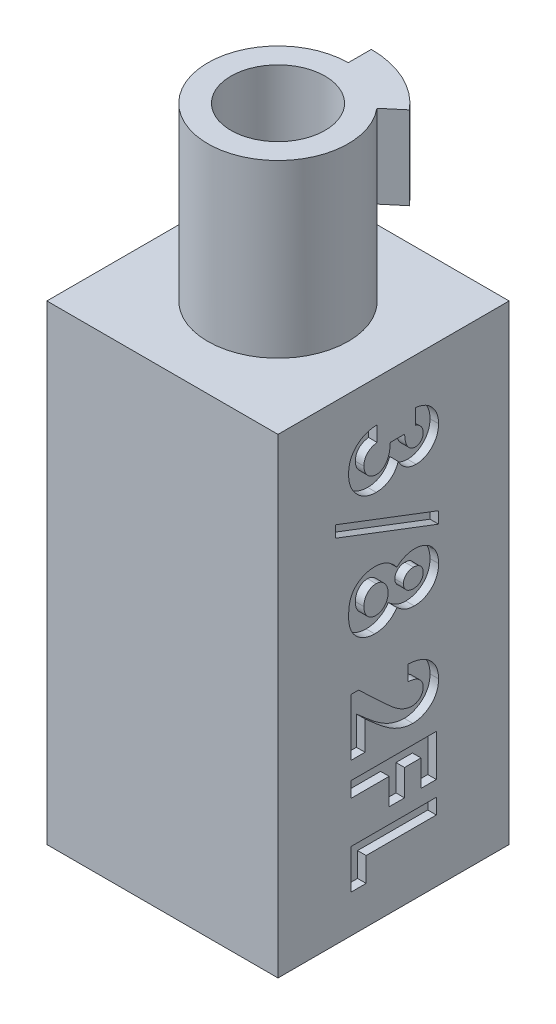
from build123d import *

# Parameters (mm, degrees)
SKETCH1_W           = 27
SKETCH1_H           = 27
BOSS_EXTRUDE1_DEPTH = 10
SKETCH1_3_W         = 27
SKETCH1_3_H         = 27
SKETCH1_3_R         = 5.5
BOSS_EXTRUDE2_DEPTH = 45
SKETCH1_4_R         = 8.2
SKETCH1_4_R_2       = 5.5
BOSS_EXTRUDE3_DEPTH = 65
BOSS_EXTRUDE4_START = -9.7
BOSS_EXTRUDE4_DEPTH = 9.7
CUT_EXTRUDE1_DEPTH  = 1


with BuildPart() as part:
    # Sketch1 → Boss-Extrude1 (new body)
    with BuildSketch(Plane(origin=(0, 0, 0), x_dir=(1, 0, 0), z_dir=(0, 1, 0))):
        Rectangle(SKETCH1_W, SKETCH1_H)
    extrude(amount=-BOSS_EXTRUDE1_DEPTH)

    # Sketch1<3> → Boss-Extrude2 (add)
    with BuildSketch(Plane(origin=(0, 0, 0), x_dir=(1, 0, 0), z_dir=(0, 1, 0))):
        Rectangle(SKETCH1_3_W, SKETCH1_3_H)
        Circle(SKETCH1_3_R, mode=Mode.SUBTRACT)
    extrude(amount=BOSS_EXTRUDE2_DEPTH)

    # Sketch1<4> → Boss-Extrude3 (add)
    with BuildSketch(Plane(origin=(0, 0, 0), x_dir=(1, 0, 0), z_dir=(0, 1, 0))):
        Circle(SKETCH1_4_R)
        Circle(SKETCH1_4_R_2, mode=Mode.SUBTRACT)
    extrude(amount=BOSS_EXTRUDE3_DEPTH)

    # Sketch2 → Boss-Extrude4 (add)
    with BuildSketch(Plane(origin=(0, 65, 0), x_dir=(1, 0, 0), z_dir=(0, 1, 0)).offset(BOSS_EXTRUDE4_START)):
        with BuildLine():
            Line((0, 8.2), (0, 10.9))
            ThreePointArc((0, 10.9), (4.606539053, 9.878754879), (8.34988443, 7.006384946))
            Line((8.34988443, 7.006384946), (6.281564434, 5.270858399))
            ThreePointArc((6.281564434, 5.270858399), (3.465469746, 7.431723854), (0, 8.2))
        make_face()
    extrude(amount=BOSS_EXTRUDE4_DEPTH)

    # Sketch3 → Cut-Extrude1 (cut)
    # profile 1 of 6: a face of its own
    with BuildSketch(Plane(origin=(13.5, 0, 0), x_dir=(0, 0, -1), z_dir=(1, 0, 0))):
        with BuildLine():
            Line((2.564102564, 37.884615385), (2.564102564, 39.679487179))
            add(Edge.make_bspline(
                [(2.564102564, 39.679487179), (2.653821802, 39.666814702), (2.829710425, 39.641971149), (3.084353334, 39.58252385), (3.325899561, 39.511418466), (3.553584178, 39.422647026), (3.767812766, 39.318532569), (3.969320453, 39.200133822), (4.157242331, 39.066170852), (4.270447216, 38.963486815), (4.326923077, 38.912259615)],
                knots=[0, 0, 0, 0, 1.111473889, 2.178970933, 3.205615836, 4.199322666, 5.174200091, 6.12565194, 7.064921805, 8, 8, 8, 8], degree=3))
            add(Edge.make_bspline(
                [(4.326923077, 38.912259615), (4.401438883, 38.838371167), (4.548301705, 38.692744801), (4.736416757, 38.449386063), (4.899217542, 38.194301164), (5.028287182, 37.922374263), (5.132754103, 37.637836747), (5.202924769, 37.338425877), (5.249483626, 37.025365153), (5.254069836, 36.811740592), (5.256410256, 36.702724359)],
                knots=[0, 0, 0, 0, 1.01925491, 2.00884431, 2.983262333, 3.955970413, 4.92937149, 5.924503185, 6.940838805, 8, 8, 8, 8], degree=3))
            add(Edge.make_bspline(
                [(5.256410256, 36.702724359), (5.254122141, 36.605803318), (5.249624166, 36.415276083), (5.213516866, 36.135248986), (5.150188683, 35.868266585), (5.067388504, 35.611506796), (4.954725023, 35.368745719), (4.823946701, 35.134625382), (4.663541655, 34.915687116), (4.482300095, 34.711418647), (4.286269605, 34.523759099), (4.076729133, 34.361245108), (3.859275988, 34.221528914), (3.632103545, 34.10642125), (3.394827401, 34.017919099), (3.148818268, 33.956495981), (2.894618984, 33.91629306), (2.721843154, 33.912287798), (2.634214744, 33.91025641)],
                knots=[0, 0, 0, 0, 1.091422571, 2.145516843, 3.172569842, 4.178562979, 5.178154469, 6.181868002, 7.194278174, 8.227918432, 9.254613415, 10.245994977, 11.209837596, 12.161663635, 13.10878368, 14.055455738, 15.013766427, 16, 16, 16, 16], degree=3))
            add(Edge.make_bspline(
                [(2.634214744, 33.91025641), (2.525694254, 33.914424939), (2.312050773, 33.922631491), (1.999367667, 33.989972192), (1.700386816, 34.095378701), (1.419291414, 34.247648656), (1.156846443, 34.438024882), (0.921826227, 34.671610135), (0.710545967, 34.9417513), (0.59700393, 35.144549872), (0.538862179, 35.248397436)],
                knots=[0, 0, 0, 0, 0.992805628, 1.954529043, 2.915727527, 3.886831945, 4.871318353, 5.87440735, 6.911542536, 8, 8, 8, 8], degree=3))
            add(Edge.make_bspline(
                [(0.538862179, 35.248397436), (0.51545966, 35.177118061), (0.469474759, 35.037057286), (0.378908016, 34.837977736), (0.279933578, 34.648675832), (0.164951371, 34.472411284), (0.038610767, 34.30743093), (-0.10016824, 34.154740509), (-0.251083047, 34.013427731), (-0.414963628, 33.88579947), (-0.589189032, 33.772524401), (-0.769734755, 33.670888714), (-0.959338807, 33.587236877), (-1.15583578, 33.516373358), (-1.360991686, 33.462421909), (-1.574011564, 33.424435267), (-1.7944095, 33.402478056), (-1.943728968, 33.399129207), (-2.019230769, 33.397435897)],
                knots=[0, 0, 0, 0, 1.059543567, 2.081955587, 3.086750234, 4.076226789, 5.052108497, 6.020845489, 6.989030705, 7.970690546, 8.952259656, 9.923888338, 10.895517021, 11.877585046, 12.873342345, 13.889638361, 14.932918083, 16, 16, 16, 16], degree=3))
            add(Edge.make_bspline(
                [(-2.019230769, 33.397435897), (-2.130236535, 33.40057446), (-2.34921031, 33.406765695), (-2.670686578, 33.454024014), (-2.978833227, 33.529931773), (-3.274049635, 33.636569592), (-3.55540839, 33.776230557), (-3.824956262, 33.944768895), (-4.080366401, 34.145210283), (-4.321202383, 34.371745811), (-4.54114502, 34.622515894), (-4.731640109, 34.894689307), (-4.895167518, 35.181929196), (-5.027911275, 35.486146678), (-5.130142383, 35.807211024), (-5.204038893, 36.144413387), (-5.249250209, 36.499168733), (-5.253989743, 36.741317084), (-5.256410256, 36.864983974)],
                knots=[0, 0, 0, 0, 1.00521177, 1.982915163, 2.936446867, 3.875909237, 4.819955514, 5.776532521, 6.750505675, 7.756026749, 8.767695971, 9.766152086, 10.760201606, 11.756952477, 12.766920653, 13.807416198, 14.880231815, 16, 16, 16, 16], degree=3))
            add(Edge.make_bspline(
                [(-5.256410256, 36.864983974), (-5.253858887, 36.981971235), (-5.248870022, 37.210724342), (-5.205668516, 37.545317177), (-5.136029161, 37.863340481), (-5.037699701, 38.165491798), (-4.911012924, 38.450484738), (-4.758099879, 38.719979671), (-4.574275293, 38.971034542), (-4.363876264, 39.204805175), (-4.131072332, 39.419309718), (-3.87396589, 39.606258815), (-3.598174938, 39.768953805), (-3.30310638, 39.908468452), (-2.986127407, 40.017474263), (-2.650068766, 40.104163696), (-2.293477318, 40.164516892), (-2.048155909, 40.182923131), (-1.923076923, 40.192307692)],
                knots=[0, 0, 0, 0, 1.066693477, 2.085777942, 3.071407889, 4.032495163, 4.978645371, 5.911608997, 6.853298848, 7.810770565, 8.776420673, 9.735131334, 10.704462168, 11.693492242, 12.70668109, 13.756973703, 14.856375978, 16, 16, 16, 16], degree=3))
            Line((-1.923076923, 40.192307692), (-1.923076923, 38.397435897))
            add(Edge.make_bspline(
                [(-1.923076923, 38.397435897), (-1.985969191, 38.386061982), (-2.108468375, 38.363908299), (-2.285819962, 38.320698899), (-2.449526431, 38.264391022), (-2.6010428, 38.199285108), (-2.742358427, 38.128960918), (-2.868254176, 38.04399248), (-2.982148633, 37.950605835), (-3.117547618, 37.815848224), (-3.256664424, 37.623202939), (-3.377563545, 37.363067981), (-3.448425284, 37.073692474), (-3.457070199, 36.871390136), (-3.461538462, 36.766826923)],
                knots=[0, 0, 0, 0, 0.928156231, 1.807827665, 2.648129825, 3.438902246, 4.202261636, 4.936546065, 5.639352463, 6.338805438, 7.70633318, 9.064371875, 10.482673459, 12, 12, 12, 12], degree=3))
            add(Edge.make_bspline(
                [(-3.461538462, 36.766826923), (-3.460588929, 36.71134118), (-3.458729009, 36.602657022), (-3.43804467, 36.44302989), (-3.404122878, 36.290910138), (-3.357340249, 36.145672478), (-3.300393632, 36.006135056), (-3.225089708, 35.876234866), (-3.138113652, 35.753305262), (-3.041351593, 35.637575322), (-2.932620978, 35.533578406), (-2.817643329, 35.441834967), (-2.695701233, 35.363867006), (-2.567063036, 35.303246611), (-2.434626712, 35.250920391), (-2.294801222, 35.218704171), (-2.15028413, 35.194438311), (-2.051391816, 35.193024985), (-2.001201923, 35.192307692)],
                knots=[0, 0, 0, 0, 1.110156356, 2.174547939, 3.215517325, 4.225827361, 5.226274409, 6.226006852, 7.223592408, 8.238489974, 9.24054302, 10.230036266, 11.179350721, 12.129887733, 13.073255049, 14.023133956, 14.996699621, 16, 16, 16, 16], degree=3))
            add(Edge.make_bspline(
                [(-2.001201923, 35.192307692), (-1.946309903, 35.194209041), (-1.837032468, 35.197994189), (-1.677565029, 35.228919251), (-1.524170206, 35.277756459), (-1.377527302, 35.345597307), (-1.238176814, 35.436191199), (-1.103322949, 35.54309098), (-0.979984611, 35.674718587), (-0.858068402, 35.819131699), (-0.751794237, 35.986594176), (-0.653718798, 36.168950361), (-0.575681027, 36.370992857), (-0.505978843, 36.587789627), (-0.45506945, 36.823441583), (-0.418104269, 37.076485415), (-0.390589421, 37.346512926), (-0.386641963, 37.532646399), (-0.384615385, 37.628205128)],
                knots=[0, 0, 0, 0, 0.809814727, 1.612155564, 2.388397, 3.182215007, 3.988903953, 4.837162975, 5.715530372, 6.646997145, 7.623086902, 8.637258368, 9.698941581, 10.815059213, 11.996518529, 13.252603015, 14.589518788, 16, 16, 16, 16], degree=3))
            Line((-0.384615385, 37.628205128), (1.282051282, 37.628205128))
            add(Edge.make_bspline(
                [(1.282051282, 37.628205128), (1.292192728, 37.509231218), (1.311165365, 37.286654593), (1.35538504, 36.977671289), (1.415105019, 36.717041177), (1.48590342, 36.498707498), (1.577314096, 36.31767744), (1.680660623, 36.161373941), (1.79637151, 36.024009657), (1.927085689, 35.908793522), (2.068404565, 35.819459688), (2.215392461, 35.754031138), (2.366041964, 35.711239363), (2.469010858, 35.707153002), (2.520032051, 35.705128205)],
                knots=[0, 0, 0, 0, 1.700000582, 3.18036443, 4.43953496, 5.503843555, 6.439238578, 7.317314143, 8.167035247, 8.988963526, 9.788142765, 10.537231438, 11.275196671, 12, 12, 12, 12], degree=3))
            add(Edge.make_bspline(
                [(2.520032051, 35.705128205), (2.585164882, 35.708555447), (2.71229038, 35.715244697), (2.89344968, 35.768571715), (3.056783525, 35.857216326), (3.198059443, 35.980507148), (3.317504747, 36.130123291), (3.402478321, 36.306663441), (3.4536758, 36.504210994), (3.458858217, 36.642976689), (3.461538462, 36.71474359)],
                knots=[0, 0, 0, 0, 1.009121812, 1.969592135, 2.901310697, 3.870954244, 4.859448864, 5.850870115, 6.888512099, 8, 8, 8, 8], degree=3))
            add(Edge.make_bspline(
                [(3.461538462, 36.71474359), (3.458344511, 36.779781352), (3.452006736, 36.908836192), (3.404492731, 37.097476817), (3.325317361, 37.2764162), (3.214132667, 37.441065293), (3.081976174, 37.591019161), (2.926723972, 37.716752429), (2.754448534, 37.81910709), (2.627799957, 37.862693683), (2.564102564, 37.884615385)],
                knots=[0, 0, 0, 0, 0.988439209, 1.961366134, 2.938893463, 3.950078543, 4.971412263, 5.967491143, 6.977757845, 8, 8, 8, 8], degree=3))
        make_face()
    # profile 2 of 6: a face of its own
    with BuildSketch(Plane(origin=(13.5, 0, 0), x_dir=(0, 0, -1), z_dir=(1, 0, 0))):
        Polygon((-6.794871795, 32.497996795), (5.256410256, 27.896634615), (5.256410256, 26.538461538), (-6.794871795, 31.139823718), align=None)
    # profile 3 of 6: a face of its own
    with BuildSketch(Plane(origin=(13.5, 0, 0), x_dir=(0, 0, -1), z_dir=(1, 0, 0))):
        with BuildLine():
            add(Edge.make_bspline(
                [(0.384615385, 20.536858974), (0.30968099, 20.432007711), (0.161355116, 20.224464095), (-0.104244998, 19.950179975), (-0.401313683, 19.714475935), (-0.72541849, 19.516372355), (-1.07184425, 19.359382017), (-1.435854911, 19.250240977), (-1.812735309, 19.178224471), (-2.069645315, 19.170547535), (-2.199519231, 19.166666667)],
                knots=[0, 0, 0, 0, 1.013587101, 2.00630422, 2.994011285, 3.992114894, 4.989775356, 5.97925768, 6.978468294, 8, 8, 8, 8], degree=3))
            add(Edge.make_bspline(
                [(-2.199519231, 19.166666667), (-2.340132714, 19.171414092), (-2.61902151, 19.180830002), (-3.028012621, 19.264078404), (-3.420932225, 19.39773238), (-3.793457423, 19.580389381), (-4.133960118, 19.809433784), (-4.435544593, 20.076314068), (-4.689290726, 20.381341907), (-4.8630938, 20.664150948), (-4.977381769, 20.908342124), (-5.050799141, 21.105705607), (-5.115792489, 21.314712434), (-5.166806089, 21.536474641), (-5.207464416, 21.770495437), (-5.234019706, 22.016099788), (-5.253391407, 22.274000017), (-5.255387006, 22.449880664), (-5.256410256, 22.540064103)],
                knots=[0, 0, 0, 0, 1.313617677, 2.605392066, 3.884780464, 5.185935486, 6.472524403, 7.710665271, 8.938515847, 10.168840141, 10.802872812, 11.45687894, 12.13623113, 12.848002783, 13.582919397, 14.355812389, 15.156936857, 16, 16, 16, 16], degree=3))
            add(Edge.make_bspline(
                [(-5.256410256, 22.540064103), (-5.25510557, 22.6362354), (-5.252557774, 22.82403898), (-5.237156654, 23.098191343), (-5.208750846, 23.356794445), (-5.171394529, 23.60040684), (-5.121830828, 23.828738606), (-5.059608317, 24.041385926), (-4.987335191, 24.238834408), (-4.878722744, 24.481642636), (-4.709884787, 24.760541454), (-4.46031079, 25.060528498), (-4.165000344, 25.324476532), (-3.827663539, 25.550225639), (-3.457007007, 25.734069999), (-3.05826679, 25.867437018), (-2.636062844, 25.947153707), (-2.346765608, 25.956686477), (-2.199519231, 25.961538462)],
                knots=[0, 0, 0, 0, 0.88703354, 1.732201599, 2.531328366, 3.285652326, 4.004418811, 4.684576848, 5.327555525, 5.942246152, 7.135747701, 8.320909842, 9.528957099, 10.7758759, 12.053844946, 13.33337118, 14.64274046, 16, 16, 16, 16], degree=3))
            add(Edge.make_bspline(
                [(-2.199519231, 25.961538462), (-2.071004776, 25.958241945), (-1.818309692, 25.951760078), (-1.44953457, 25.884113384), (-1.097231044, 25.781637119), (-0.764840574, 25.630194832), (-0.446965461, 25.44112569), (-0.148930805, 25.206989397), (0.132906208, 24.932425863), (0.299320606, 24.724142372), (0.384615385, 24.617387821)],
                knots=[0, 0, 0, 0, 1.017764427, 2.001207311, 2.962560812, 3.919839309, 4.888525119, 5.888134187, 6.91757486, 8, 8, 8, 8], degree=3))
            add(Edge.make_bspline(
                [(0.384615385, 24.617387821), (0.460933841, 24.683585927), (0.611181897, 24.813910061), (0.853144307, 24.982218171), (1.101788672, 25.125142572), (1.35816109, 25.241987854), (1.62135474, 25.334959725), (1.892316923, 25.401403725), (2.171042388, 25.439803344), (2.358992717, 25.445726279), (2.453926282, 25.448717949)],
                knots=[0, 0, 0, 0, 1.061613381, 2.089997026, 3.093172129, 4.073384372, 5.048150668, 6.023851993, 7.001849177, 8, 8, 8, 8], degree=3))
            add(Edge.make_bspline(
                [(2.453926282, 25.448717949), (2.582435925, 25.444740918), (2.8359805, 25.43689439), (3.206603965, 25.366950433), (3.55950478, 25.25182147), (3.891145704, 25.091328564), (4.197920109, 24.892024095), (4.471334972, 24.654051268), (4.706277935, 24.377108412), (4.904033024, 24.066344236), (5.063257936, 23.725295248), (5.175056231, 23.355692522), (5.245063738, 22.961394117), (5.252570547, 22.689270522), (5.256410256, 22.550080128)],
                knots=[0, 0, 0, 0, 1.022656772, 2.017662422, 2.99130931, 3.971194851, 4.94315582, 5.896612183, 6.847142801, 7.825150805, 8.821987795, 9.834571622, 10.89238995, 12, 12, 12, 12], degree=3))
            add(Edge.make_bspline(
                [(5.256410256, 22.550080128), (5.252575281, 22.412893406), (5.245097883, 22.145408023), (5.175290406, 21.757433779), (5.061095873, 21.394618114), (4.899817861, 21.059667079), (4.699797094, 20.753212229), (4.457590682, 20.481153641), (4.177132978, 20.244163889), (3.863078164, 20.042583684), (3.524888193, 19.881841805), (3.170183969, 19.763034773), (2.801804331, 19.69430899), (2.551690132, 19.684447539), (2.42588141, 19.679487179)],
                knots=[0, 0, 0, 0, 1.094581014, 2.13420379, 3.135806656, 4.123102114, 5.093187509, 6.048701862, 7.020851006, 8.016190234, 9.020216833, 10.003183799, 10.99559124, 12, 12, 12, 12], degree=3))
            add(Edge.make_bspline(
                [(2.42588141, 19.679487179), (2.336968918, 19.6818812), (2.162484799, 19.686579285), (1.905382751, 19.721188667), (1.658839048, 19.779806129), (1.415927343, 19.860423045), (1.173424275, 19.97717614), (0.919619576, 20.126424209), (0.654011939, 20.316211729), (0.477242408, 20.460993499), (0.384615385, 20.536858974)],
                knots=[0, 0, 0, 0, 0.940860718, 1.84636882, 2.739437118, 3.619946589, 4.54937856, 5.582024627, 6.73298378, 8, 8, 8, 8], degree=3))
        make_face()
        with BuildLine():
            add(Edge.make_bspline(
                [(3.461538462, 22.594150641), (3.457861121, 22.66800846), (3.45067598, 22.812318976), (3.389480157, 23.01802453), (3.285469614, 23.201585701), (3.145483207, 23.360845945), (2.974535412, 23.491572398), (2.778158682, 23.587708484), (2.558591809, 23.644704433), (2.404854157, 23.650739658), (2.325721154, 23.653846154)],
                knots=[0, 0, 0, 0, 1.01799924, 1.989064885, 2.929918886, 3.909649683, 4.895861681, 5.88099644, 6.909290502, 8, 8, 8, 8], degree=3))
            add(Edge.make_bspline(
                [(2.325721154, 23.653846154), (2.245935838, 23.649958449), (2.09014732, 23.64236733), (1.865741634, 23.584081134), (1.663945942, 23.480820867), (1.486563854, 23.343450326), (1.340234372, 23.17757285), (1.230143998, 22.990046999), (1.166783478, 22.780394198), (1.158223171, 22.634628443), (1.153846154, 22.560096154)],
                knots=[0, 0, 0, 0, 1.071552291, 2.092309128, 3.087505052, 4.097995595, 5.089828334, 6.04253265, 6.99911662, 8, 8, 8, 8], degree=3))
            add(Edge.make_bspline(
                [(1.153846154, 22.560096154), (1.157255392, 22.484172537), (1.163897228, 22.336259088), (1.228623422, 22.125835673), (1.333233056, 21.936542229), (1.477850646, 21.77212926), (1.657693776, 21.640316481), (1.863122735, 21.541948774), (2.094437719, 21.48581877), (2.255974927, 21.478272341), (2.33974359, 21.474358974)],
                knots=[0, 0, 0, 0, 1.008634697, 1.965009626, 2.900280074, 3.870523963, 4.855685917, 5.849953663, 6.885046307, 8, 8, 8, 8], degree=3))
            add(Edge.make_bspline(
                [(2.33974359, 21.474358974), (2.418914637, 21.478071455), (2.572200731, 21.485259331), (2.790415764, 21.544604864), (2.985272986, 21.642761752), (3.154357756, 21.777324261), (3.29138861, 21.944778169), (3.392041417, 22.139554812), (3.450448719, 22.359797585), (3.457761831, 22.514341311), (3.461538462, 22.594150641)],
                knots=[0, 0, 0, 0, 1.066147256, 2.064208482, 3.022454516, 3.989792431, 4.955788801, 5.918128389, 6.924881755, 8, 8, 8, 8], degree=3))
        make_face(mode=Mode.SUBTRACT)
        with BuildLine():
            add(Edge.make_bspline(
                [(-0.641025641, 22.536057692), (-0.641958218, 22.59221505), (-0.643796315, 22.702900499), (-0.664992327, 22.865617206), (-0.696579628, 23.021760608), (-0.740153419, 23.171136985), (-0.799555461, 23.312991697), (-0.87116572, 23.4485272), (-0.955708085, 23.577275417), (-1.051647691, 23.69732665), (-1.156950549, 23.805824913), (-1.266778015, 23.903626227), (-1.383969428, 23.983564993), (-1.504629309, 24.050134926), (-1.629713821, 24.103624245), (-1.761282848, 24.138984726), (-1.89758426, 24.161751927), (-1.990427255, 24.165018782), (-2.037259615, 24.166666667)],
                knots=[0, 0, 0, 0, 1.129580664, 2.226389355, 3.296443603, 4.333934503, 5.352185725, 6.386189251, 7.41493955, 8.447544828, 9.47401038, 10.455044306, 11.4018853, 12.322125673, 13.225630306, 14.132028716, 15.057747923, 16, 16, 16, 16], degree=3))
            add(Edge.make_bspline(
                [(-2.037259615, 24.166666667), (-2.086099243, 24.16587757), (-2.1829666, 24.164312493), (-2.3243854, 24.140838082), (-2.460646885, 24.106766931), (-2.591365226, 24.059805277), (-2.713894965, 23.993277777), (-2.833017136, 23.917880413), (-2.945505478, 23.826792085), (-3.050610209, 23.723352811), (-3.147486329, 23.609288771), (-3.230898856, 23.484453389), (-3.305147229, 23.352299323), (-3.359047797, 23.208181594), (-3.40685455, 23.058292466), (-3.437507239, 22.898929565), (-3.458968703, 22.731624993), (-3.460667195, 22.616928317), (-3.461538462, 22.558092949)],
                knots=[0, 0, 0, 0, 0.974088129, 1.931983261, 2.853561134, 3.777354458, 4.695744306, 5.631391423, 6.589193767, 7.579120295, 8.572631576, 9.571050878, 10.573379294, 11.590932041, 12.636826139, 13.711472072, 14.826065521, 16, 16, 16, 16], degree=3))
            add(Edge.make_bspline(
                [(-3.461538462, 22.558092949), (-3.460460347, 22.498614334), (-3.458359443, 22.382709352), (-3.439791255, 22.213279695), (-3.410329341, 22.053028857), (-3.368190582, 21.902150323), (-3.31421382, 21.760066194), (-3.24549524, 21.628708795), (-3.167677358, 21.504982744), (-3.076543508, 21.393212952), (-2.978309943, 21.290468013), (-2.867562056, 21.205199738), (-2.754991316, 21.127273694), (-2.632161521, 21.067730158), (-2.504100816, 21.017743081), (-2.366647386, 20.988500505), (-2.224448672, 20.963511697), (-2.126858916, 20.962202826), (-2.077323718, 20.961538462)],
                knots=[0, 0, 0, 0, 1.200874627, 2.340124329, 3.437749396, 4.488046767, 5.499804889, 6.500992991, 7.477352102, 8.446138438, 9.409276924, 10.340154412, 11.263972269, 12.168594658, 13.09034327, 14.032386832, 15.00126702, 16, 16, 16, 16], degree=3))
            add(Edge.make_bspline(
                [(-2.077323718, 20.961538462), (-2.027192585, 20.963372088), (-1.929203594, 20.966956191), (-1.784486687, 20.986540243), (-1.647343494, 21.023365736), (-1.51435315, 21.07125479), (-1.389483221, 21.13588002), (-1.268908441, 21.212266038), (-1.157808562, 21.305624946), (-1.051137962, 21.408813807), (-0.955784824, 21.524839866), (-0.87180999, 21.649195702), (-0.799061337, 21.779459151), (-0.740248104, 21.916974846), (-0.696550534, 22.062316983), (-0.664995218, 22.214487351), (-0.643791105, 22.37320578), (-0.641956631, 22.481233763), (-0.641025641, 22.536057692)],
                knots=[0, 0, 0, 0, 1.011532607, 1.977195714, 2.93758502, 3.870769893, 4.822431657, 5.767590832, 6.743623145, 7.743613551, 8.757564061, 9.766133583, 10.766849277, 11.762476861, 12.776427371, 13.822429344, 14.894888382, 16, 16, 16, 16], degree=3))
        make_face(mode=Mode.SUBTRACT)
    # profile 4 of 6: a face of its own
    with BuildSketch(Plane(origin=(13.5, 0, 0), x_dir=(0, 0, -1), z_dir=(1, 0, 0))):
        with BuildLine():
            Line((1.666666667, 12.371794872), (1.666666667, 14.166666667))
            add(Edge.make_bspline(
                [(1.666666667, 14.166666667), (1.802439222, 14.158914891), (2.067730644, 14.143768386), (2.453074929, 14.083519417), (2.817182905, 14.002787868), (3.158780881, 13.895040897), (3.477744732, 13.759649779), (3.775161823, 13.600098475), (4.049466247, 13.412310812), (4.299335153, 13.200283529), (4.523494854, 12.967616266), (4.722248927, 12.719139424), (4.886255787, 12.451052214), (5.021218248, 12.16825281), (5.129046983, 11.870789367), (5.201139219, 11.555847412), (5.249960787, 11.226153884), (5.25423287, 11.000451967), (5.256410256, 10.885416667)],
                knots=[0, 0, 0, 0, 1.199038563, 2.342849363, 3.436047546, 4.486744587, 5.497670872, 6.488682221, 7.459191391, 8.424610317, 9.374430501, 10.305433194, 11.225809216, 12.140057399, 13.06607119, 14.010487599, 14.985989317, 16, 16, 16, 16], degree=3))
            add(Edge.make_bspline(
                [(5.256410256, 10.885416667), (5.251997136, 10.744215568), (5.243381692, 10.468557933), (5.170108781, 10.067953463), (5.046829905, 9.693459462), (4.876296386, 9.345064343), (4.65864777, 9.026950265), (4.396864869, 8.741189485), (4.09185882, 8.489566846), (3.749850202, 8.276898522), (3.387140944, 8.103086763), (3.013611534, 7.978789165), (2.637045948, 7.897631086), (2.383546539, 7.888935306), (2.257612179, 7.884615385)],
                knots=[0, 0, 0, 0, 1.075208937, 2.099059817, 3.090102131, 4.070747506, 5.044426497, 6.016695572, 7.013986309, 8.047248753, 9.078128699, 10.07077592, 11.041593041, 12, 12, 12, 12], degree=3))
            add(Edge.make_bspline(
                [(2.257612179, 7.884615385), (2.181435202, 7.886293093), (2.028109764, 7.889669906), (1.796090747, 7.913149339), (1.559752242, 7.948373114), (1.319296933, 8.001482042), (1.074657238, 8.067713008), (0.82510174, 8.1480616), (0.57204255, 8.244387512), (0.312642484, 8.355099167), (0.046015458, 8.487125182), (-0.231654238, 8.641070205), (-0.521184889, 8.820123954), (-0.820460769, 9.026230179), (-1.135968795, 9.251024001), (-1.459585763, 9.505166674), (-1.796611981, 9.781218803), (-2.021749817, 9.977355162), (-2.137419872, 10.078125)],
                knots=[0, 0, 0, 0, 0.728291422, 1.465870735, 2.227967504, 3.011895603, 3.818808047, 4.650669213, 5.517493715, 6.406970765, 7.346374078, 8.360901659, 9.441709605, 10.599840149, 11.834858619, 13.145178554, 14.533265854, 16, 16, 16, 16], degree=3))
            Line((-2.137419872, 10.078125), (-3.333333333, 11.121794872))
            Line((-3.333333333, 11.121794872), (-3.333333333, 7.756410256))
            Line((-3.333333333, 7.756410256), (-5, 7.756410256))
            Line((-5, 7.756410256), (-5, 14.423076923))
            Line((-5, 14.423076923), (-4.090544872, 14.423076923))
            Line((-4.090544872, 14.423076923), (-0.939503205, 11.462339744))
            add(Edge.make_bspline(
                [(-0.939503205, 11.462339744), (-0.847586341, 11.376618794), (-0.669570634, 11.210602735), (-0.40813563, 10.974378992), (-0.160040051, 10.760617372), (0.077357819, 10.573750395), (0.296357761, 10.403971523), (0.503560705, 10.258851183), (0.697093462, 10.137061637), (0.930460167, 10.004841811), (1.208791491, 9.87927644), (1.529440588, 9.764062612), (1.835907277, 9.693831811), (2.035607559, 9.68413774), (2.131410256, 9.679487179)],
                knots=[0, 0, 0, 0, 1.246127091, 2.413378631, 3.493388633, 4.492180848, 5.408488754, 6.240484944, 6.999099869, 7.674939598, 8.898438119, 10.020720584, 11.050475521, 12, 12, 12, 12], degree=3))
            add(Edge.make_bspline(
                [(2.131410256, 9.679487179), (2.224119549, 9.682909995), (2.403758668, 9.689542249), (2.658550927, 9.764242046), (2.890989924, 9.876011401), (3.090487422, 10.038279312), (3.255852292, 10.234132532), (3.377029671, 10.46174652), (3.448251363, 10.716942104), (3.457025007, 10.895647905), (3.461538462, 10.987580128)],
                knots=[0, 0, 0, 0, 1.061596218, 2.057012874, 3.024113775, 4.006148568, 4.986025304, 5.949989669, 6.945406325, 8, 8, 8, 8], degree=3))
            add(Edge.make_bspline(
                [(3.461538462, 10.987580128), (3.459858976, 11.03506412), (3.45655264, 11.128543982), (3.434543254, 11.265952073), (3.395754009, 11.396705744), (3.34378188, 11.522260356), (3.274892451, 11.641275956), (3.189975253, 11.75345235), (3.091188226, 11.859971459), (2.978840264, 11.960344741), (2.853459906, 12.051697532), (2.716192244, 12.132836746), (2.567122485, 12.199925369), (2.408218577, 12.258992631), (2.237773763, 12.304548129), (2.056808136, 12.337718184), (1.865616104, 12.362935161), (1.734189559, 12.36878791), (1.666666667, 12.371794872)],
                knots=[0, 0, 0, 0, 0.903469896, 1.778625579, 2.63899355, 3.493148037, 4.358286772, 5.247621495, 6.164656832, 7.118446693, 8.109501108, 9.111810964, 10.146451449, 11.215617525, 12.33435995, 13.498009769, 14.714554818, 16, 16, 16, 16], degree=3))
        make_face()
    # profile 5 of 6: a face of its own
    with BuildSketch(Plane(origin=(13.5, 0, 0), x_dir=(0, 0, -1), z_dir=(1, 0, 0))):
        Polygon((5, 5.705128205), (5, 0.833333333), (3.205128205, 0.833333333), (3.205128205, 3.91025641), (1.282051282, 3.91025641), (1.282051282, 0.833333333), (-0.512820513, 0.833333333), (-0.512820513, 3.91025641), (-5, 3.91025641), (-5, 5.705128205), align=None)
    # profile 6 of 6: a face of its own
    with BuildSketch(Plane(origin=(13.5, 0, 0), x_dir=(0, 0, -1), z_dir=(1, 0, 0))):
        Polygon((5, -0.961538462), (5, -2.756410256), (-3.205128205, -2.756410256), (-3.205128205, -5.576923077), (-5, -5.576923077), (-5, -0.961538462), align=None)
    extrude(amount=-CUT_EXTRUDE1_DEPTH, mode=Mode.SUBTRACT)


solid = part.part
